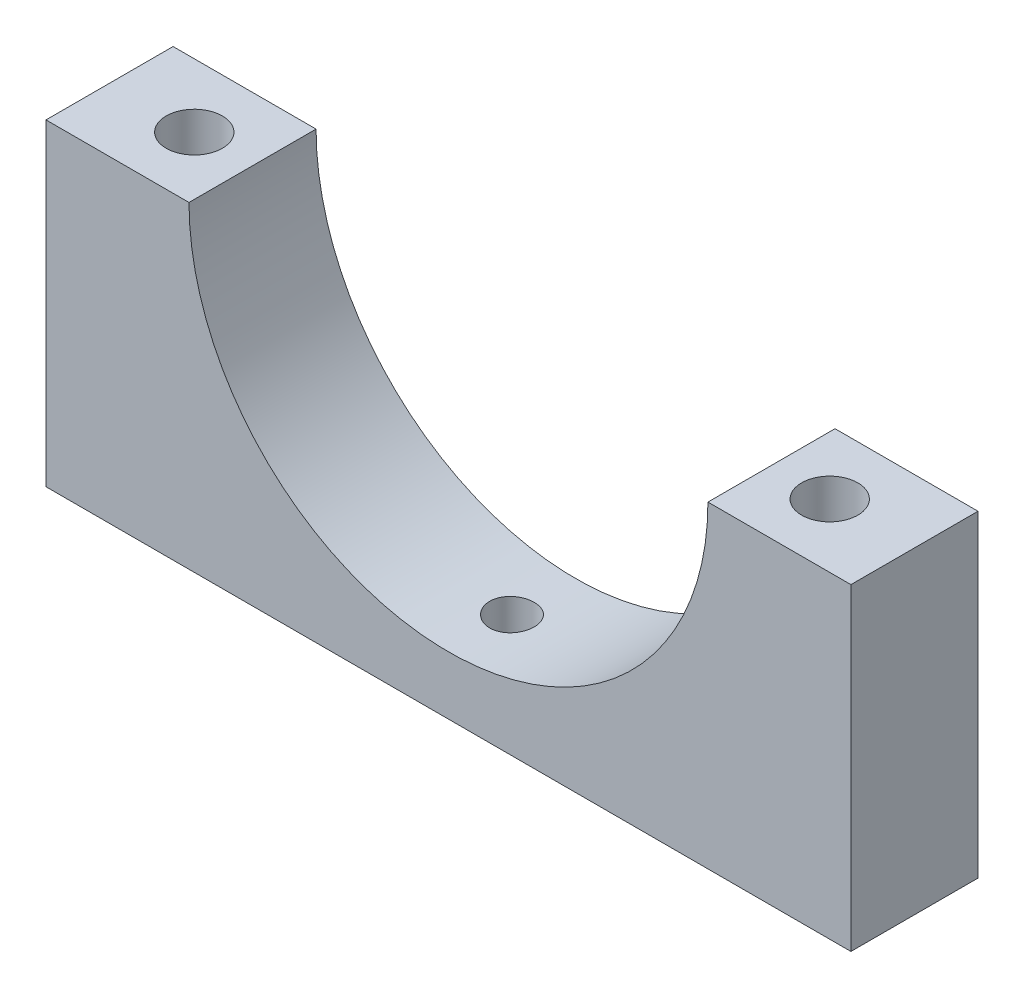
from build123d import *

# Parameters (mm, degrees)
SKETCH_1_W                = 76
SKETCH_1_H                = 12
EXTRUDE_1_DEPTH           = 30
CUT_EXTRUDE_1_REACH       = 51.88
SKETCH_2_R                = 24.5
HOLE_WIZARD_M5_1_D        = 4.2
HOLE_WIZARD_1_D           = 5.3
HOLE_WIZARD_1_CBORE_D     = 10
HOLE_WIZARD_1_CBORE_DEPTH = 8.7


with BuildPart() as part:
    # 草图1 → 凸台-拉伸1 (new body)
    with BuildSketch(Plane(origin=(0, 0, 0), x_dir=(1, 0, 0), z_dir=(0, 1, 0))):
        Rectangle(SKETCH_1_W, SKETCH_1_H)
    extrude(amount=-EXTRUDE_1_DEPTH)

    # 草图2 → 切除-拉伸1 (cut, up to next)
    with BuildSketch(Plane.XY.offset(6), mode=Mode.PRIVATE) as cut_extrude_1_sk1:
        Circle(SKETCH_2_R)
    cut_extrude_1_tool1 = extrude(cut_extrude_1_sk1.sketch, amount=-CUT_EXTRUDE_1_REACH, mode=Mode.PRIVATE) & part.part
    add(cut_extrude_1_tool1.solids().sort_by_distance((0, 0, 6))[0], mode=Mode.SUBTRACT)

    # M5 螺纹孔1 (through all)
    with Locations(Plane.XZ.offset(30)):
        with Locations((0, 0)):
            Hole(HOLE_WIZARD_M5_1_D / 2)

    # 打孔尺寸根据内六角圆柱头螺钉的类型1 (through all)
    with Locations(Plane.XZ.offset(30)):
        with Locations((-30, 0), (30, 0)):
            CounterBoreHole(HOLE_WIZARD_1_D / 2, HOLE_WIZARD_1_CBORE_D / 2, HOLE_WIZARD_1_CBORE_DEPTH)


solid = part.part
